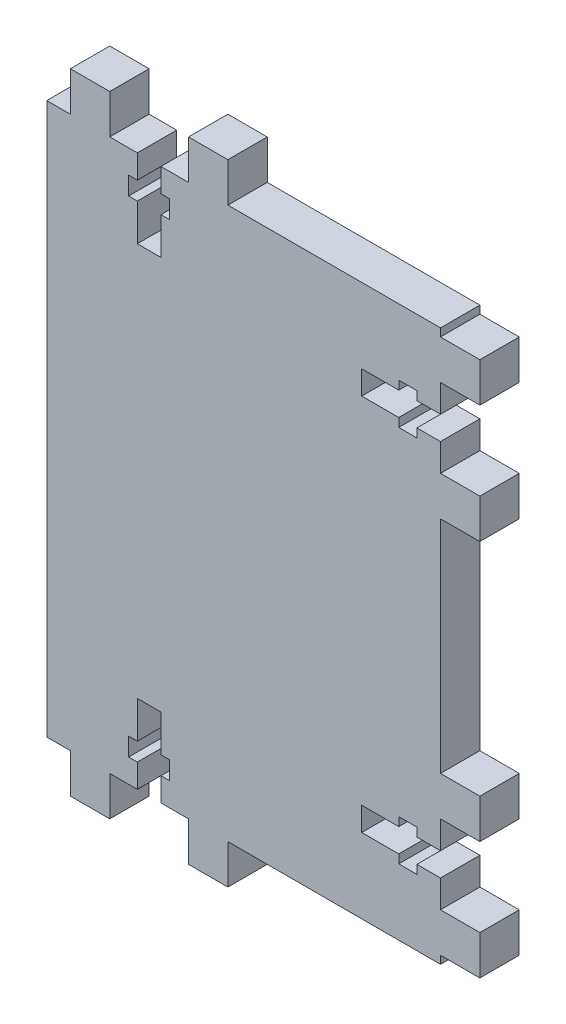
from build123d import *

# Parameters (mm, degrees)
BOSS_EXTRU_1_DEPTH = 5


with BuildPart() as part:
    # Esquisse1 → Boss.-Extru.1 (new body)
    with BuildSketch(Plane.XY):
        Polygon((23, 0), (50, 0), (50, 1), (55, 1), (55, 6), (50, 6), (50, 9.5), (47, 9.5), (47, 8.4), (44.7, 8.4), (44.7, 9.5), (40, 9.5), (40, 12.5), (44.7, 12.5), (44.7, 13.6), (47, 13.6), (47, 12.5), (50, 12.5), (50, 16), (55, 16), (55, 21), (50, 21), (50, 49), (55, 49), (55, 54), (50, 54), (50, 57.5), (47, 57.5), (47, 56.4), (44.7, 56.4), (44.7, 57.5), (40, 57.5), (40, 60.5), (44.7, 60.5), (44.7, 61.6), (47, 61.6), (47, 60.5), (50, 60.5), (50, 64), (55, 64), (55, 69), (50, 69), (50, 70), (23, 70), (23, 75), (18, 75), (18, 70), (14.5, 70), (14.5, 67), (15.6, 67), (15.6, 64.7), (14.5, 64.7), (14.5, 60), (11.5, 60), (11.5, 64.7), (10.4, 64.7), (10.4, 67), (11.5, 67), (11.5, 70), (8, 70), (8, 75), (3, 75), (3, 70), (0, 70), (0, 0), (3, 0), (3, -5), (8, -5), (8, 0), (11.5, 0), (11.5, 3), (10.4, 3), (10.4, 5.3), (11.5, 5.3), (11.5, 10), (14.5, 10), (14.5, 5.3), (15.6, 5.3), (15.6, 3), (14.5, 3), (14.5, 0), (18, 0), (18, -5), (23, -5), align=None)
    extrude(amount=BOSS_EXTRU_1_DEPTH)


solid = part.part
